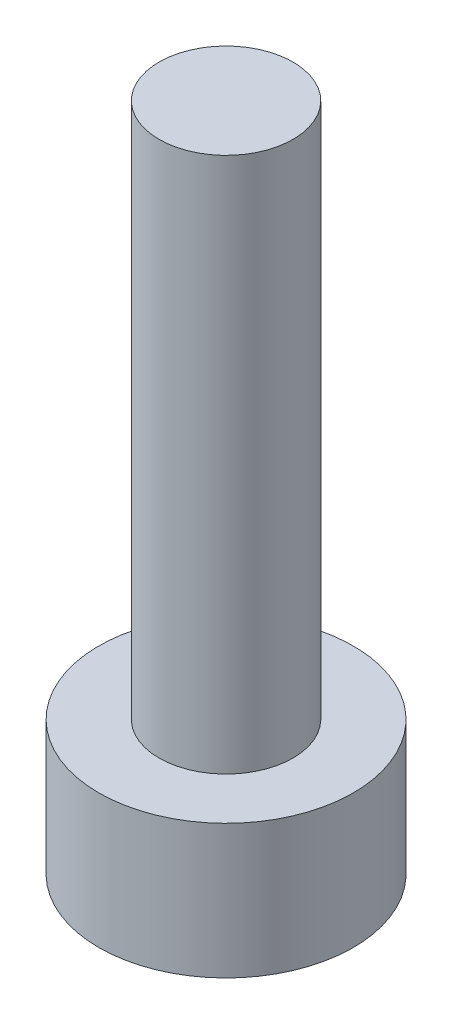
from build123d import *

# Parameters (mm, degrees)
SKETCH1_R           = 1.9
BOSS_EXTRUDE1_DEPTH = 2
SKETCH2_R           = 1
BOSS_EXTRUDE2_DEPTH = 8
CUT_EXTRUDE1_DEPTH  = 1


with BuildPart() as part:
    # Sketch1 → Boss-Extrude1 (new body)
    with BuildSketch(Plane(origin=(0, 0, 0), x_dir=(1, 0, 0), z_dir=(0, 1, 0))):
        with Locations(Location((0, 0, 0), (0, 0, 270))):
            Circle(SKETCH1_R)
    extrude(amount=BOSS_EXTRUDE1_DEPTH)

    # Sketch2 → Boss-Extrude2 (add)
    with BuildSketch(Plane(origin=(0, 2, 0), x_dir=(1, 0, 0), z_dir=(0, 1, 0))):
        with Locations(Location((0, 0, 0), (0, 0, 270))):
            Circle(SKETCH2_R)
    extrude(amount=BOSS_EXTRUDE2_DEPTH)

    # Sketch3 → Cut-Extrude1 (cut)
    with BuildSketch(Plane(origin=(0, 0, 0), x_dir=(-1, 0, 0), z_dir=(0, -1, 0))):
        Polygon((-0.866025404, 0), (-0.433012702, -0.75), (0.433012702, -0.75), (0.866025404, 0), (0.433012702, 0.75), (-0.433012702, 0.75), align=None)
    extrude(amount=-CUT_EXTRUDE1_DEPTH, mode=Mode.SUBTRACT)


solid = part.part
